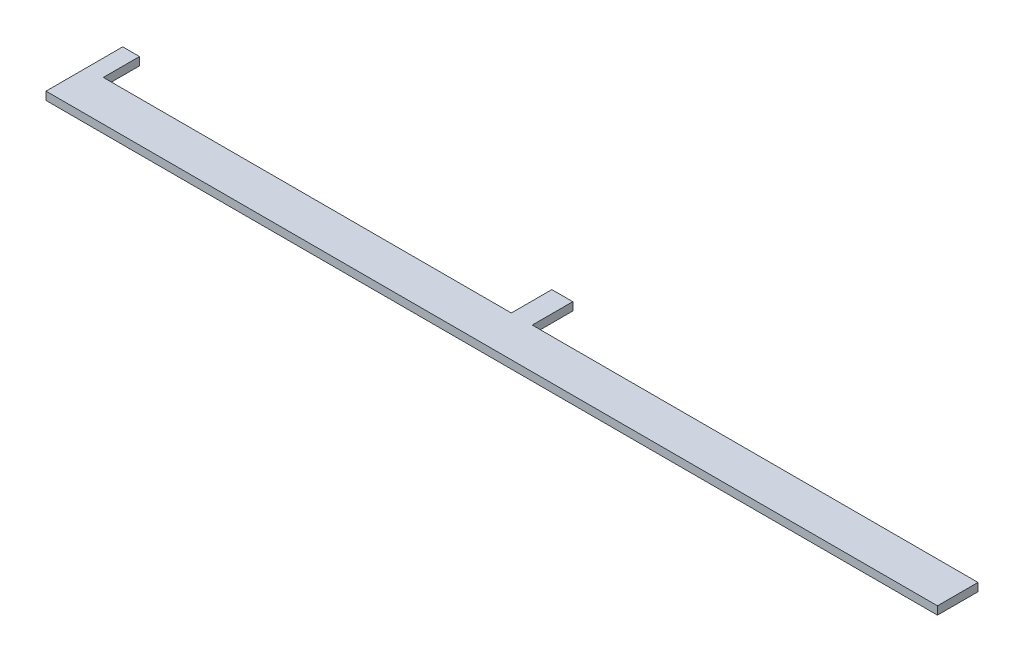
from build123d import *

# Parameters (mm, degrees)
BOSS_EXTRUDE1_DEPTH = 2


with BuildPart() as part:
    # Sketch1 → Boss-Extrude1 (new body)
    with BuildSketch(Plane(origin=(0, 0, 0), x_dir=(1, 0, 0), z_dir=(0, 1, 0))):
        Polygon((110, -5), (-110, -5), (-110, 5), (-110, 13.93086099), (-105.853581382, 13.93086099), (-105.853581382, 5), (-5.164865529, 5), (-5.164865529, 15), (0, 15), (0, 5), (110, 5), align=None)
    extrude(amount=BOSS_EXTRUDE1_DEPTH)


solid = part.part
